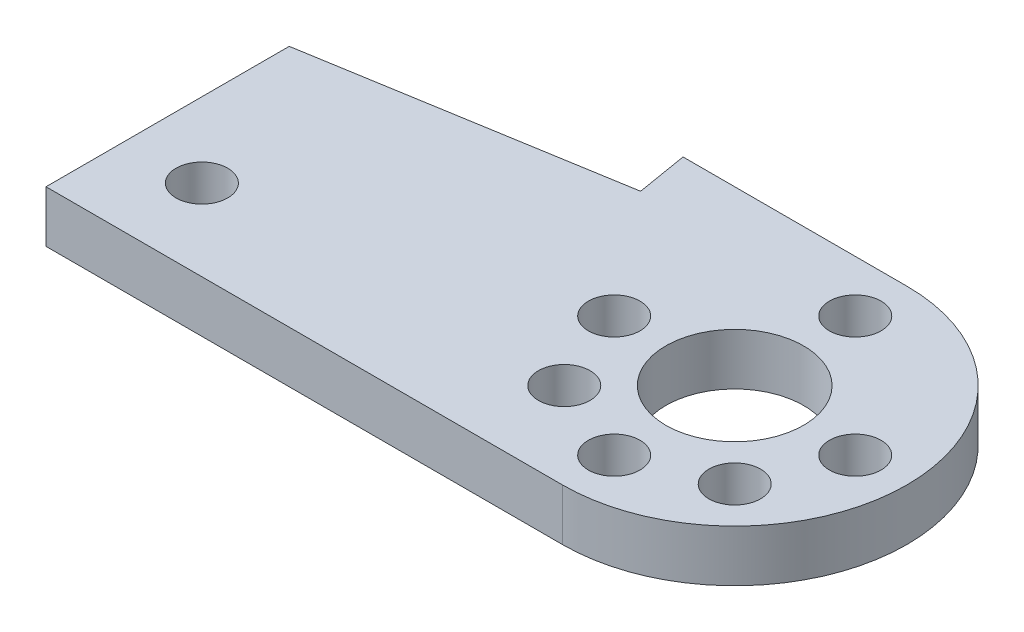
from build123d import *

# Parameters (mm, degrees)
SKETCH_1_R          = 10
EXTRUDE_1_DEPTH     = 3
SKETCH_2_R          = 4
CUT_EXTRUDE_1_DEPTH = 15.456832295
SKETCH_3_R          = 1.5
CUT_EXTRUDE_2_DEPTH = 15.456832295
EXTRUDE_START       = -3
EXTRUDE_3_DEPTH     = 3
CUT_EXTRUDE_3_DEPTH = 32.764760349
SKETCH_10_R         = 1.5
CUT_EXTRUDE_6_DEPTH = 32.764760349


with BuildPart() as part:
    # 草图1 → 凸台-拉伸1 (new body)
    with BuildSketch(Plane(origin=(0, 0, 0), x_dir=(1, 0, 0), z_dir=(0, 1, 0))):
        with Locations(Location((0, 0, 0), (0, 0, 270))):
            Circle(SKETCH_1_R)
    extrude(amount=EXTRUDE_1_DEPTH)

    # 草图2 → 切除-拉伸1 (cut, through all)
    with BuildSketch(Plane(origin=(0, 3, 0), x_dir=(1, 0, 0), z_dir=(0, 1, 0))):
        with Locations(Location((0, 0, 0), (0, 0, 270))):
            Circle(SKETCH_2_R)
    extrude(amount=-CUT_EXTRUDE_1_DEPTH, mode=Mode.SUBTRACT)

    # 草图3 → 切除-拉伸2 (cut, through all)
    with BuildSketch(Plane(origin=(0, 3, 0), x_dir=(1, 0, 0), z_dir=(0, 1, 0))):
        with Locations(Location((7, 0, 0), (0, 0, 270))):
            Circle(SKETCH_3_R)
        with Locations(Location((4.949747468, -4.949747468, 0), (0, 0, 270))):
            Circle(SKETCH_3_R)
        with Locations(Location((0, -7, 0), (0, 0, 270))):
            Circle(SKETCH_3_R)
        with Locations(Location((-4.949747468, -4.949747468, 0), (0, 0, 270))):
            Circle(SKETCH_3_R)
        with Locations(Location((-7, 0, 0), (0, 0, 270))):
            Circle(SKETCH_3_R)
        with Locations(Location((0, 7, 0), (0, 0, 270))):
            Circle(SKETCH_3_R)
    extrude(amount=-CUT_EXTRUDE_2_DEPTH, mode=Mode.SUBTRACT)

    # 草图6 → 凸台-拉伸3 (add)
    with BuildSketch(Plane(origin=(0, 3, 0), x_dir=(1, 0, 0), z_dir=(0, 1, 0)).offset(EXTRUDE_START)):
        with BuildLine():
            Line((0, 10), (-30, 10))
            Line((-30, 10), (-30, -10))
            Line((-30, -10), (0, -10))
            ThreePointArc((0, -10), (-10, 0), (0, 10))
        make_face()
    extrude(amount=EXTRUDE_3_DEPTH)

    # 草图7 → 切除-拉伸3 (cut, through all)
    with BuildSketch(Plane(origin=(0, 3, 0), x_dir=(1, 0, 0), z_dir=(0, 1, 0))):
        Polygon((-30, 4.125285706), (-12.506803088, 7.04081822), (-13, 10), (-30, 10), align=None)
    extrude(amount=-CUT_EXTRUDE_3_DEPTH, mode=Mode.SUBTRACT)

    # 草图10 → 切除-拉伸6 (cut, through all)
    with BuildSketch(Plane.XZ):
        with Locations(Location((-25.658723667, 5.289102386, 0), (0, 0, 270))):
            Circle(SKETCH_10_R)
    extrude(amount=-CUT_EXTRUDE_6_DEPTH, mode=Mode.SUBTRACT)


solid = part.part
